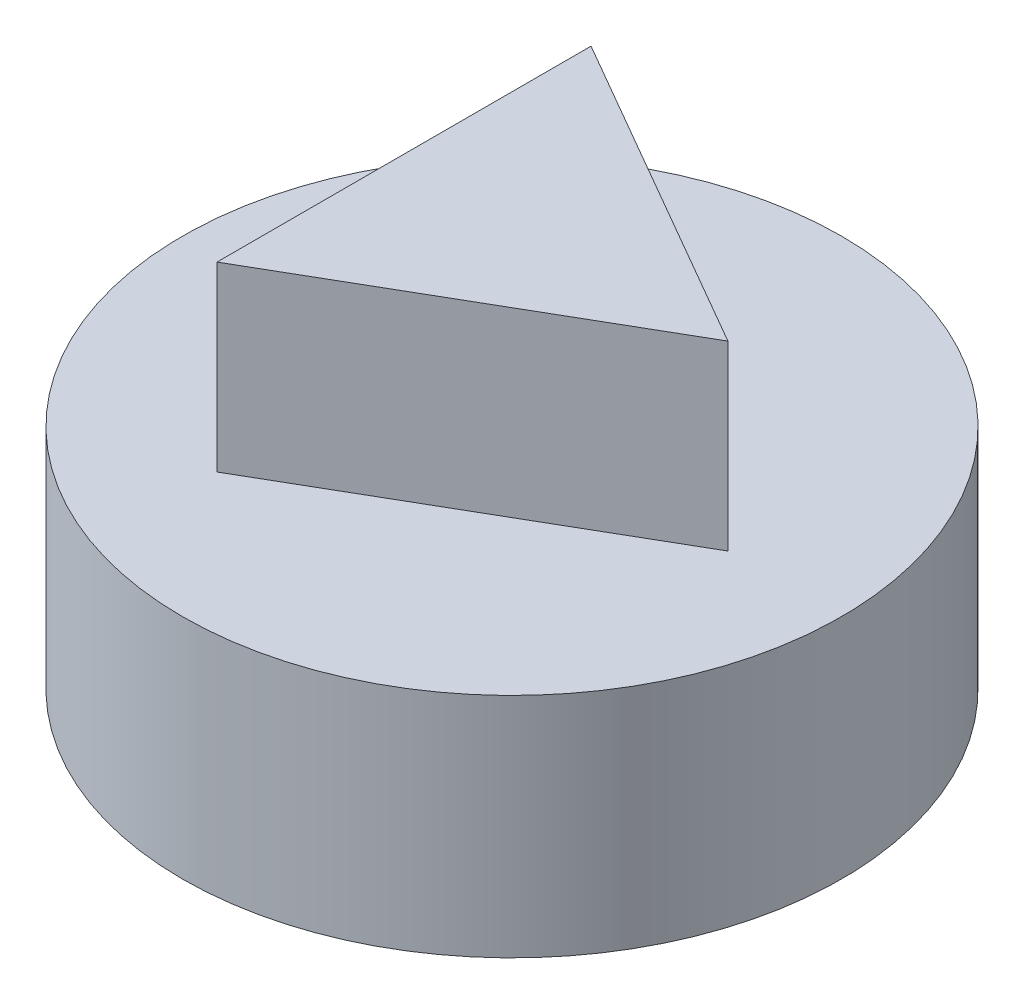
from build123d import *

# Parameters (mm, degrees)
SKETCH1_R           = 7.25
BOSS_EXTRUDE1_DEPTH = 5
BOSS_EXTRUDE2_DEPTH = 4


with BuildPart() as part:
    # Sketch1 → Boss-Extrude1 (new body)
    with BuildSketch(Plane(origin=(0, 0, 0), x_dir=(1, 0, 0), z_dir=(0, 1, 0))):
        with Locations(Location((0, 0, 0), (0, 0, 270))):
            Circle(SKETCH1_R)
    extrude(amount=BOSS_EXTRUDE1_DEPTH)

    # Sketch2 → Boss-Extrude2 (add)
    with BuildSketch(Plane(origin=(0, 5, 0), x_dir=(1, 0, 0), z_dir=(0, 1, 0))):
        Polygon((4.75, 0), (-2.375, 4.113620668), (-2.375, -4.113620668), align=None)
    extrude(amount=BOSS_EXTRUDE2_DEPTH)


solid = part.part
